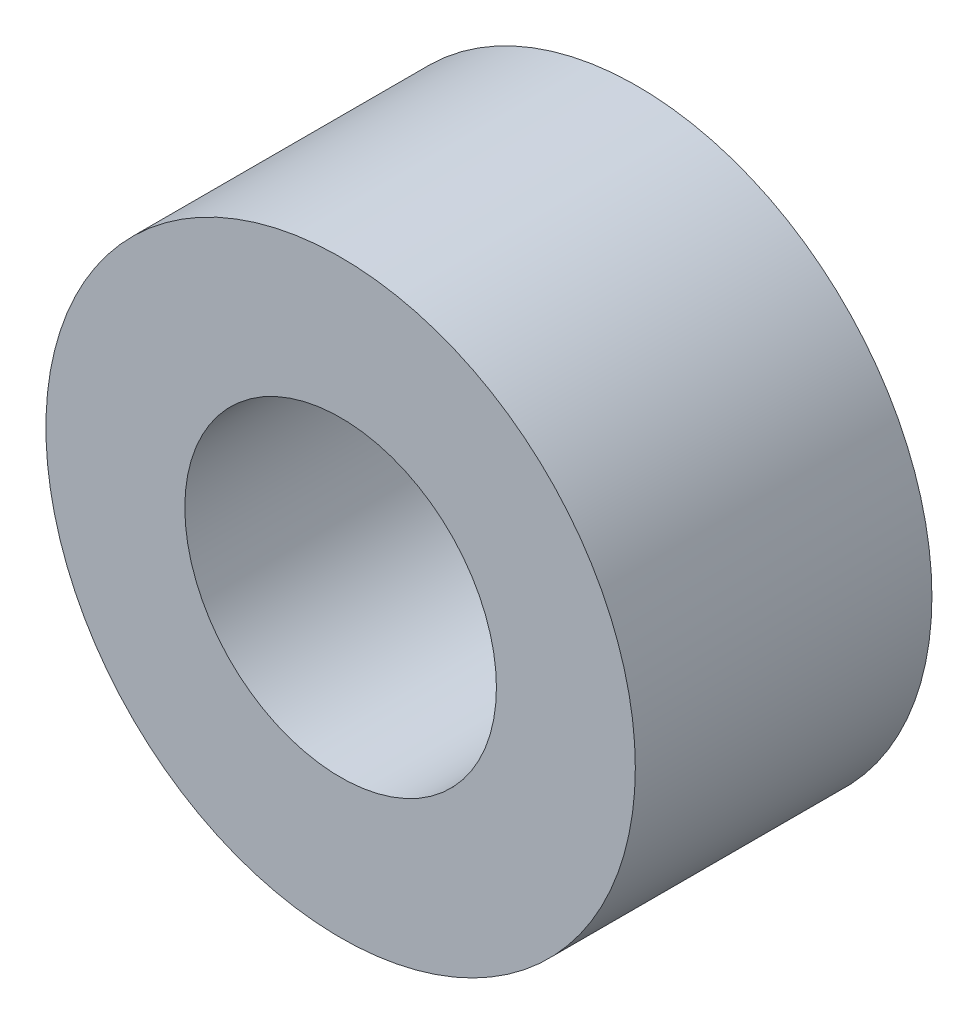
from build123d import *

# Parameters (mm, degrees)
SKETCH1_R           = 7.85
SKETCH1_R_2         = 4.15
BOSS_EXTRUDE1_DEPTH = 7.9


with BuildPart() as part:
    # Sketch1 → Boss-Extrude1 (new body)
    with BuildSketch(Plane.XY):
        Circle(SKETCH1_R)
        Circle(SKETCH1_R_2, mode=Mode.SUBTRACT)
    extrude(amount=BOSS_EXTRUDE1_DEPTH)


solid = part.part
